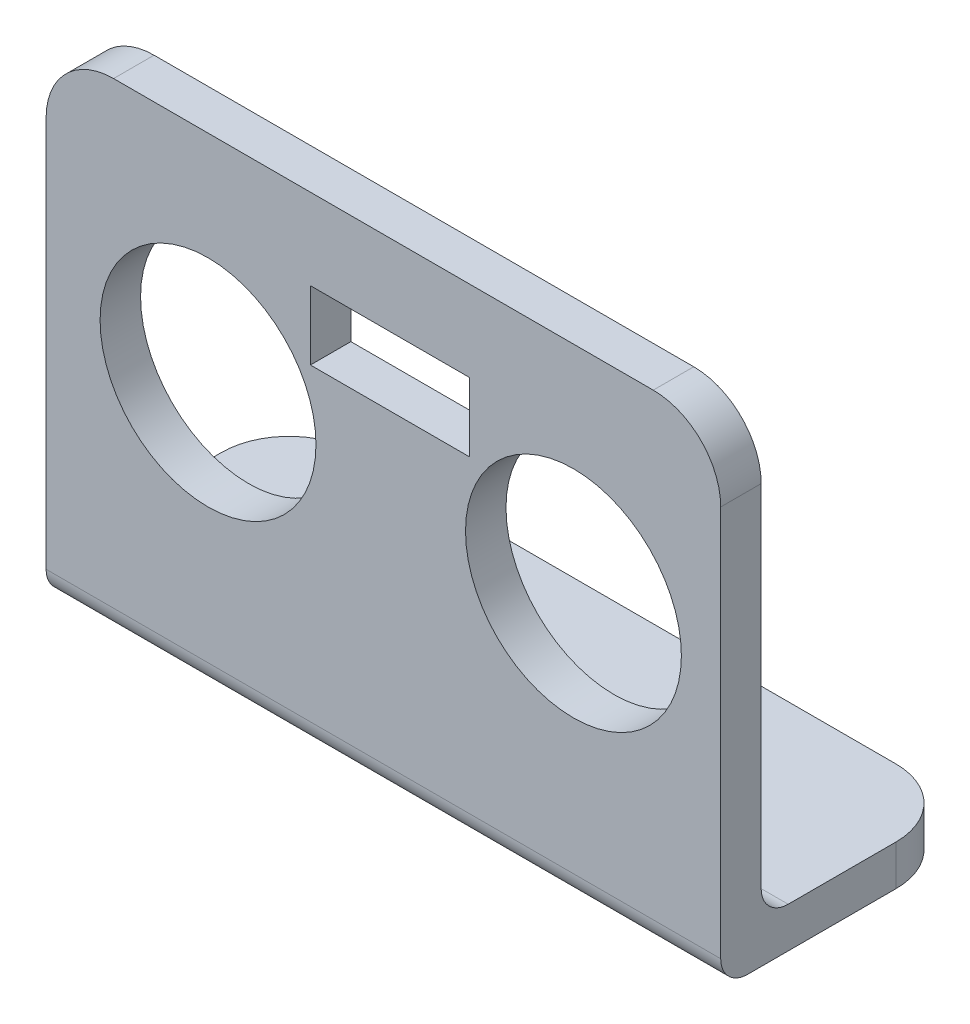
from build123d import *

# Parameters (mm, degrees)
SKETCH1_W           = 50
SKETCH1_H           = 36
SKETCH1_R           = 8
SKETCH1_W_2         = 11.807071599
SKETCH1_H_2         = 5.093325141
BOSS_EXTRUDE1_DEPTH = 3
SKETCH2_W           = 50
SKETCH2_H           = 18
SKETCH2_R           = 1.6
BOSS_EXTRUDE2_DEPTH = 3
FILLET1_R           = 5
FILLET2_R           = 2


with BuildPart() as part:
    # Sketch1 → Boss-Extrude1 (new body)
    with BuildSketch(Plane.XY):
        with Locations((0, 18)):
            Rectangle(SKETCH1_W, SKETCH1_H)
        with Locations((-13, 20)):
            Circle(SKETCH1_R, mode=Mode.SUBTRACT)
        with Locations((14.084852814, 20)):
            Circle(SKETCH1_R, mode=Mode.SUBTRACT)
        with Locations((0.491645941, 27.45333743)):
            Rectangle(SKETCH1_W_2, SKETCH1_H_2, mode=Mode.SUBTRACT)
    extrude(amount=BOSS_EXTRUDE1_DEPTH)

    # Sketch2 → Boss-Extrude2 (add)
    with BuildSketch(Plane(origin=(0, 0, 0), x_dir=(1, 0, 0), z_dir=(0, 1, 0))):
        with Locations((0, 6)):
            Rectangle(SKETCH2_W, SKETCH2_H)
        with Locations(Location((0, 7.5, 0), (0, 0, 270))):
            Circle(SKETCH2_R, mode=Mode.SUBTRACT)
        with Locations(Location((-11, 7.5, 0), (0, 0, 270))):
            Circle(SKETCH2_R, mode=Mode.SUBTRACT)
        with Locations(Location((11, 7.5, 0), (0, 0, 270))):
            Circle(SKETCH2_R, mode=Mode.SUBTRACT)
    extrude(amount=BOSS_EXTRUDE2_DEPTH)

    # Fillet1
    fillet1_edges = [part.edges().sort_by_distance(p)[0] for p in [
        (-25, 1.5, -15),
        (25, 1.5, -15),
        (-25, 36, 1.5),
        (25, 36, 1.5),
    ]]
    fillet(fillet1_edges, radius=FILLET1_R)

    # Fillet2
    fillet2_edges = [part.edges().sort_by_distance(p)[0] for p in [
        (0, 3, 0),
        (0, 0, 3),
    ]]
    fillet(fillet2_edges, radius=FILLET2_R)


solid = part.part
